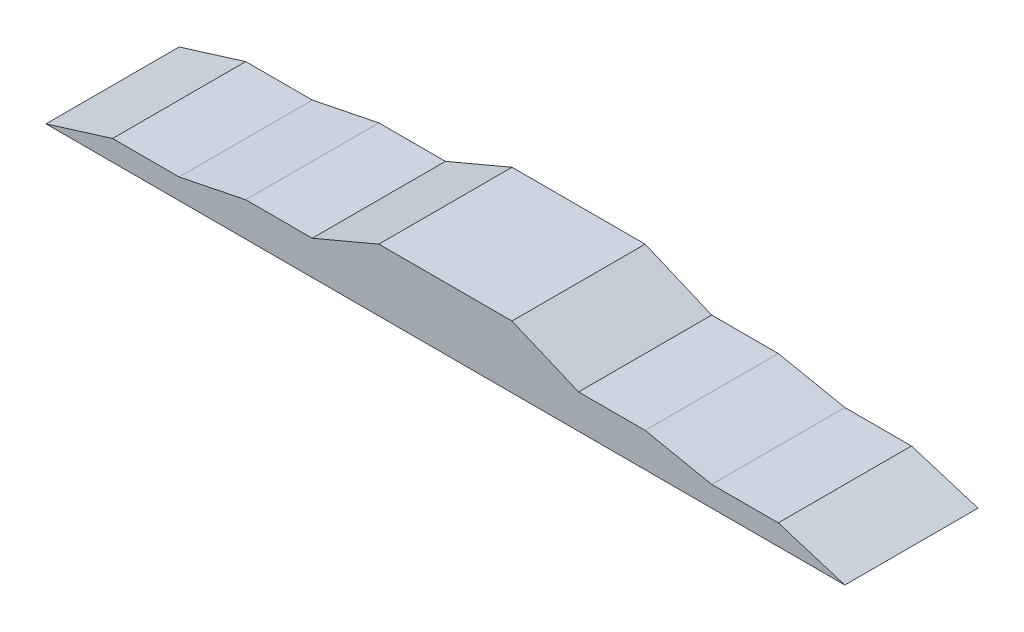
from build123d import *

# Parameters (mm, degrees)
EXTRUDE_1_DEPTH = 100


with BuildPart() as part:
    # 草图1 → 凸台-拉伸1 (new body)
    with BuildSketch(Plane.XY):
        Polygon((-200, 15.46681248), (-150, 25.602314256), (-100, 25.602314256), (-50, 46.741975193), (50, 46.741975193), (100, 25.602314256), (150, 25.602314256), (200, 15.46681248), (250, 15.46681248), (300, 0), (-300, 0), (-250, 15.46681248), align=None)
    extrude(amount=EXTRUDE_1_DEPTH)


solid = part.part
